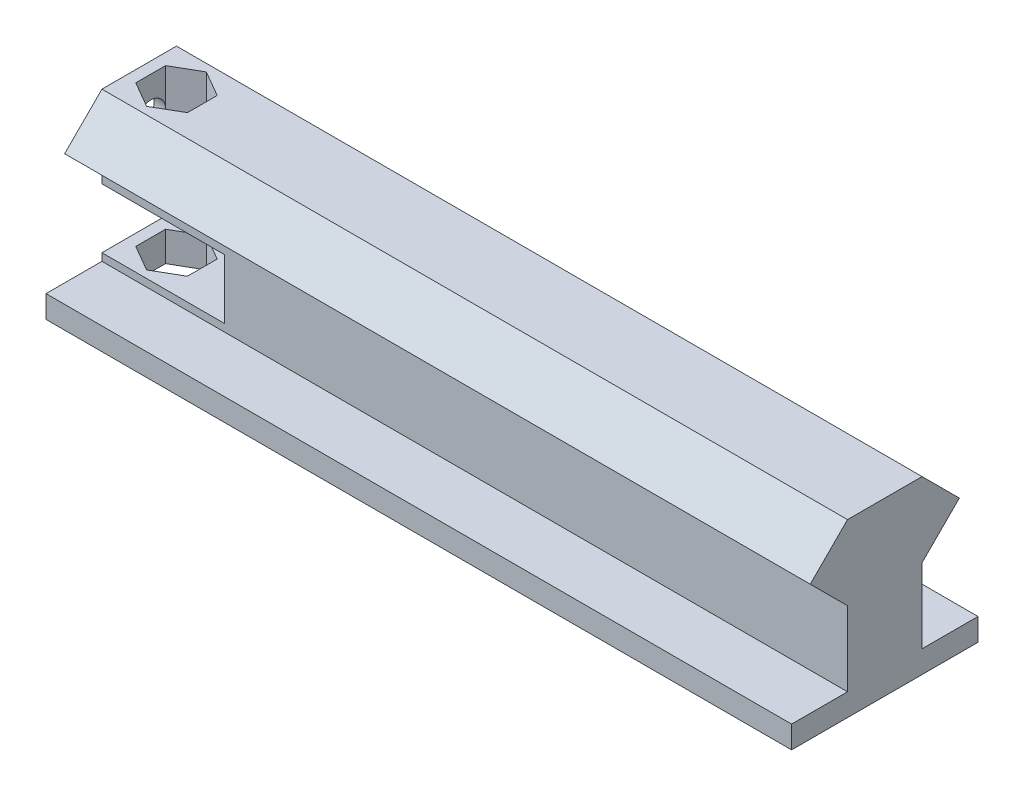
from build123d import *

# Parameters (mm, degrees)
BOSS_EXTRUDE1_DEPTH     = 50
SKETCH2_R               = 12.5
CUT_EXTRUDE1_DEPTH      = 4
CUT_EXTRUDE3_DEPTH      = 54.677276384
CUT_EXTRUDE3_DEPTH_BACK = 54.677276384
SKETCH6_R               = 2
CUT_EXTRUDE4_DEPTH      = 4


with BuildPart() as part:
    # Sketch1 → Boss-Extrude1 (new, symmetric)
    with BuildSketch(Plane(origin=(0, 0, 0), x_dir=(0, 0, -1), z_dir=(1, 0, 0))):
        Polygon((5, 5), (10, 10), (5, 15), (-5, 15), (-10, 10), (-5, 5), (-5, -5), (-12.5, -5), (-12.5, -8), (12.5, -8), (12.5, -5), (5, -5), align=None)
    extrude(amount=BOSS_EXTRUDE1_DEPTH, both=True)

    # Sketch2 → Cut-Extrude1 (cut, symmetric)
    with BuildSketch(Plane(origin=(0, 0, 0), x_dir=(1, 0, 0), z_dir=(0, 1, 0))):
        with Locations((-45, 0)):
            Circle(SKETCH2_R)
    extrude(amount=CUT_EXTRUDE1_DEPTH, both=True, mode=Mode.SUBTRACT)

    # Sketch4 → Cut-Extrude3 (cut, two sides: drawn at the far end of the back side and taken through both)
    with BuildSketch(Plane(origin=(0, 0, 0), x_dir=(1, 0, 0), z_dir=(0, 1, 0)).offset(-CUT_EXTRUDE3_DEPTH_BACK)):
        Polygon((-45, -4), (-41.535898385, -2), (-41.535898385, 2), (-45, 4), (-48.464101615, 2), (-48.464101615, -2), align=None)
    extrude(amount=CUT_EXTRUDE3_DEPTH + CUT_EXTRUDE3_DEPTH_BACK, mode=Mode.SUBTRACT)

    # Sketch6 → Cut-Extrude4 (cut)
    with BuildSketch(Plane.ZY.offset(50)):
        with Locations((0, 10)):
            Circle(SKETCH6_R)
    extrude(amount=-CUT_EXTRUDE4_DEPTH, mode=Mode.SUBTRACT)


solid = part.part
